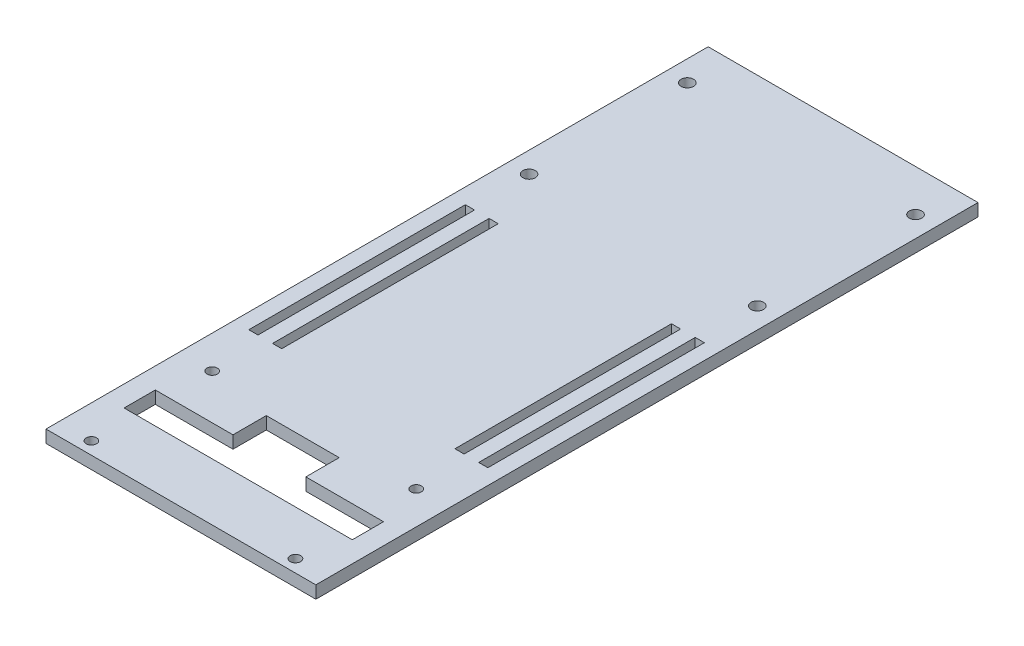
from build123d import *

# Parameters (mm, degrees)
SKETCH1_W           = 64.8
SKETCH1_H           = 159
SKETCH1_R           = 1.5
BOSS_EXTRUDE1_DEPTH = 3
SKETCH7_W           = 2.2
SKETCH7_H           = 52
CUT_EXTRUDE4_DEPTH  = 86.901164136
CUT_EXTRUDE6_DEPTH  = 86.901164136
SKETCH12_R          = 1.25
CUT_EXTRUDE8_DEPTH  = 10


with BuildPart() as part:
    # Sketch1 → Boss-Extrude1 (new body)
    with BuildSketch(Plane(origin=(0, 0, 0), x_dir=(1, 0, 0), z_dir=(0, 1, 0))):
        Rectangle(SKETCH1_W, SKETCH1_H)
        with Locations(Location((-27.4, 69.5, 0), (0, 0, 270))):
            Circle(SKETCH1_R, mode=Mode.SUBTRACT)
        with Locations(Location((27.4, 69.5, 0), (0, 0, 270))):
            Circle(SKETCH1_R, mode=Mode.SUBTRACT)
        with Locations(Location((27.4, 31.5, 0), (0, 0, 270))):
            Circle(SKETCH1_R, mode=Mode.SUBTRACT)
        with Locations(Location((-27.4, 31.5, 0), (0, 0, 270))):
            Circle(SKETCH1_R, mode=Mode.SUBTRACT)
    extrude(amount=BOSS_EXTRUDE1_DEPTH)

    # Sketch7 → Cut-Extrude4 (cut, through all)
    with BuildSketch(Plane(origin=(0, 3, 0), x_dir=(1, 0, 0), z_dir=(0, 1, 0))):
        with Locations((-27.6, -8.5)):
            Rectangle(SKETCH7_W, SKETCH7_H)
        with Locations((27.6, -8.5)):
            Rectangle(SKETCH7_W, SKETCH7_H)
        with Locations((-21.9, -8.5)):
            Rectangle(SKETCH7_W, SKETCH7_H)
        with Locations((21.9, -8.5)):
            Rectangle(SKETCH7_W, SKETCH7_H)
    extrude(amount=-CUT_EXTRUDE4_DEPTH, mode=Mode.SUBTRACT)

    # Sketch9 → Cut-Extrude6 (cut, through all)
    with BuildSketch(Plane(origin=(0, 3, 0), x_dir=(1, 0, 0), z_dir=(0, 1, 0))):
        Polygon((-27.4, -65.75), (27.4, -65.75), (27.4, -58.25), (8.75, -58.25), (8.75, -50.25), (-8.75, -50.25), (-8.75, -58.25), (-27.4, -58.25), align=None)
    extrude(amount=-CUT_EXTRUDE6_DEPTH, mode=Mode.SUBTRACT)

    # Sketch12 → Cut-Extrude8 (cut)
    with BuildSketch(Plane(origin=(0, 3, 0), x_dir=(1, 0, 0), z_dir=(0, 1, 0))):
        with Locations(Location((-24.5, -47.5, 0), (0, 0, 270))):
            Circle(SKETCH12_R)
        with Locations(Location((24.5, -47.5, 0), (0, 0, 270))):
            Circle(SKETCH12_R)
        with Locations(Location((24.5, -76.5, 0), (0, 0, 270))):
            Circle(SKETCH12_R)
        with Locations(Location((-24.5, -76.5, 0), (0, 0, 270))):
            Circle(SKETCH12_R)
    extrude(amount=-CUT_EXTRUDE8_DEPTH, mode=Mode.SUBTRACT)


solid = part.part
